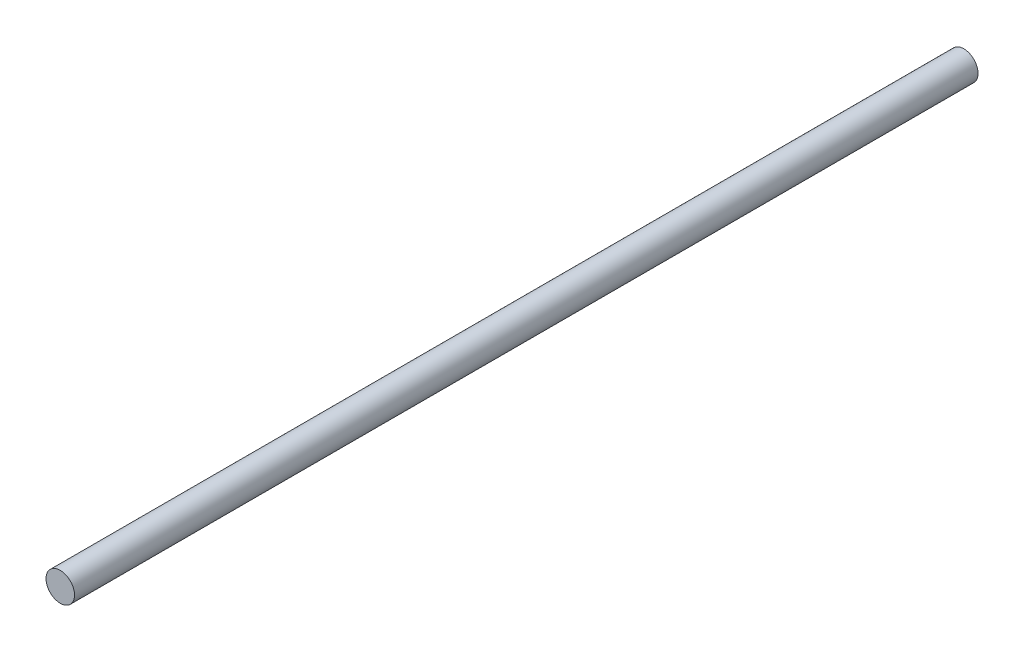
from build123d import *

# Parameters (mm, degrees)
SKETCH1_R           = 15
BOSS_EXTRUDE1_DEPTH = 950


with BuildPart() as part:
    # Sketch1 → Boss-Extrude1 (new body)
    with BuildSketch(Plane.XY):
        with Locations(Location((0, 0, 0), (0, 0, 180))):
            Circle(SKETCH1_R)
    extrude(amount=BOSS_EXTRUDE1_DEPTH)


solid = part.part
